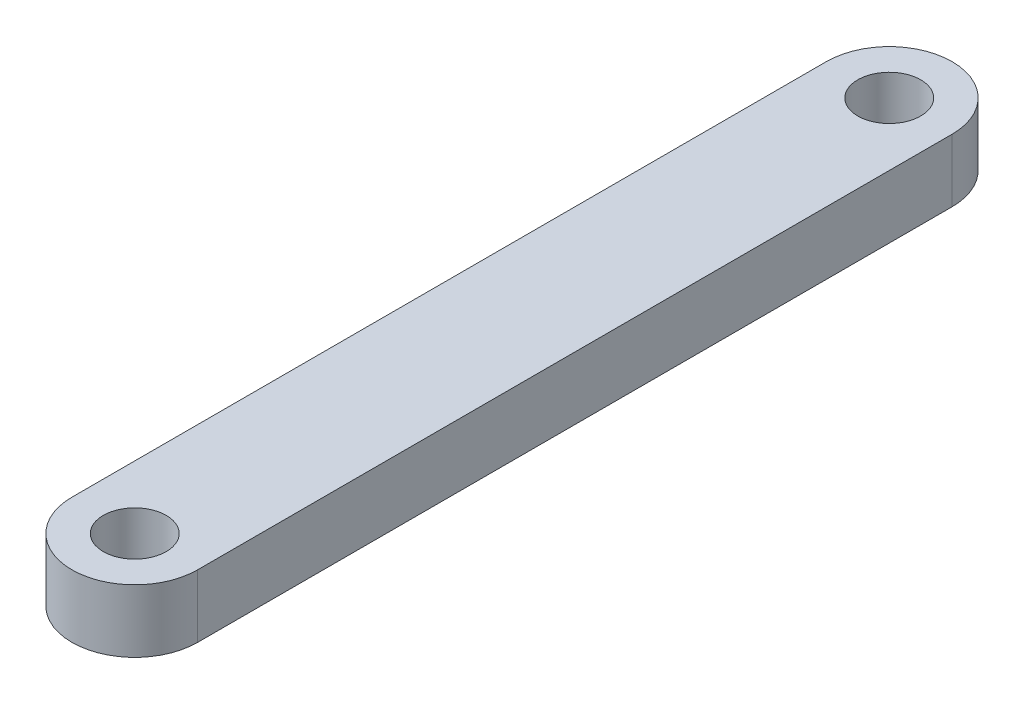
from build123d import *

# Parameters (mm, degrees)
ESQUISSE1_R        = 1.5
BOSS_EXTRU_1_DEPTH = 3


with BuildPart() as part:
    # Esquisse1 → Boss.-Extru.1 (new body)
    with BuildSketch(Plane(origin=(0, 0, 0), x_dir=(1, 0, 0), z_dir=(0, 1, 0))):
        with BuildLine():
            Line((-3, 0), (-3, -36))
            ThreePointArc((-3, -36), (0, -39), (3, -36))
            Line((3, -36), (3, 0))
            ThreePointArc((3, 0), (0, 3), (-3, 0))
        make_face()
        with Locations(Location((0, 0, 0), (0, 0, 270))):
            Circle(ESQUISSE1_R, mode=Mode.SUBTRACT)
        with Locations(Location((0, -36, 0), (0, 0, 90))):
            Circle(ESQUISSE1_R, mode=Mode.SUBTRACT)
    extrude(amount=BOSS_EXTRU_1_DEPTH)


solid = part.part
